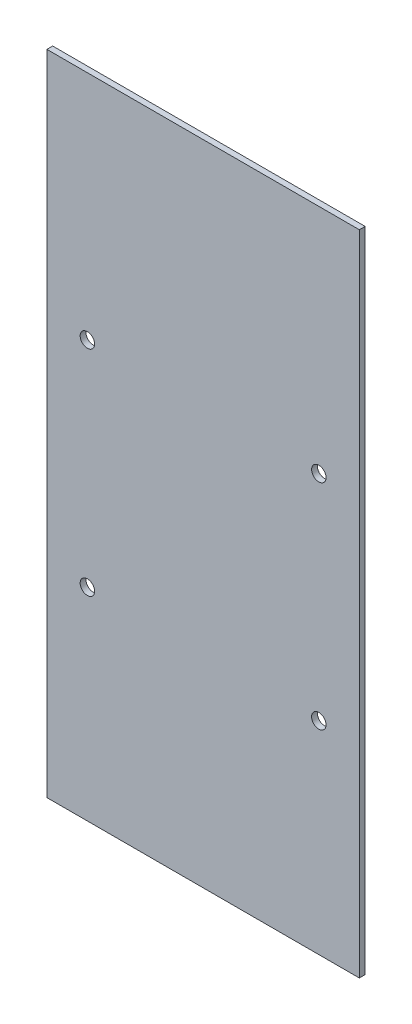
from build123d import *

# Parameters (mm, degrees)
SKETCH_1_W      = 54
SKETCH_1_H      = 112
SKETCH_1_R      = 1.25
EXTRUDE_1_DEPTH = 1


with BuildPart() as part:
    # 草图1 → 凸台-拉伸1 (new body)
    with BuildSketch(Plane.XY):
        Rectangle(SKETCH_1_W, SKETCH_1_H)
        with Locations((-20, 16)):
            Circle(SKETCH_1_R, mode=Mode.SUBTRACT)
        with Locations((-20, -21)):
            Circle(SKETCH_1_R, mode=Mode.SUBTRACT)
        with Locations(Location((20, -21, 0), (0, 0, 180))):
            Circle(SKETCH_1_R, mode=Mode.SUBTRACT)
        with Locations(Location((20, 16, 0), (0, 0, 180))):
            Circle(SKETCH_1_R, mode=Mode.SUBTRACT)
    extrude(amount=EXTRUDE_1_DEPTH)


solid = part.part
